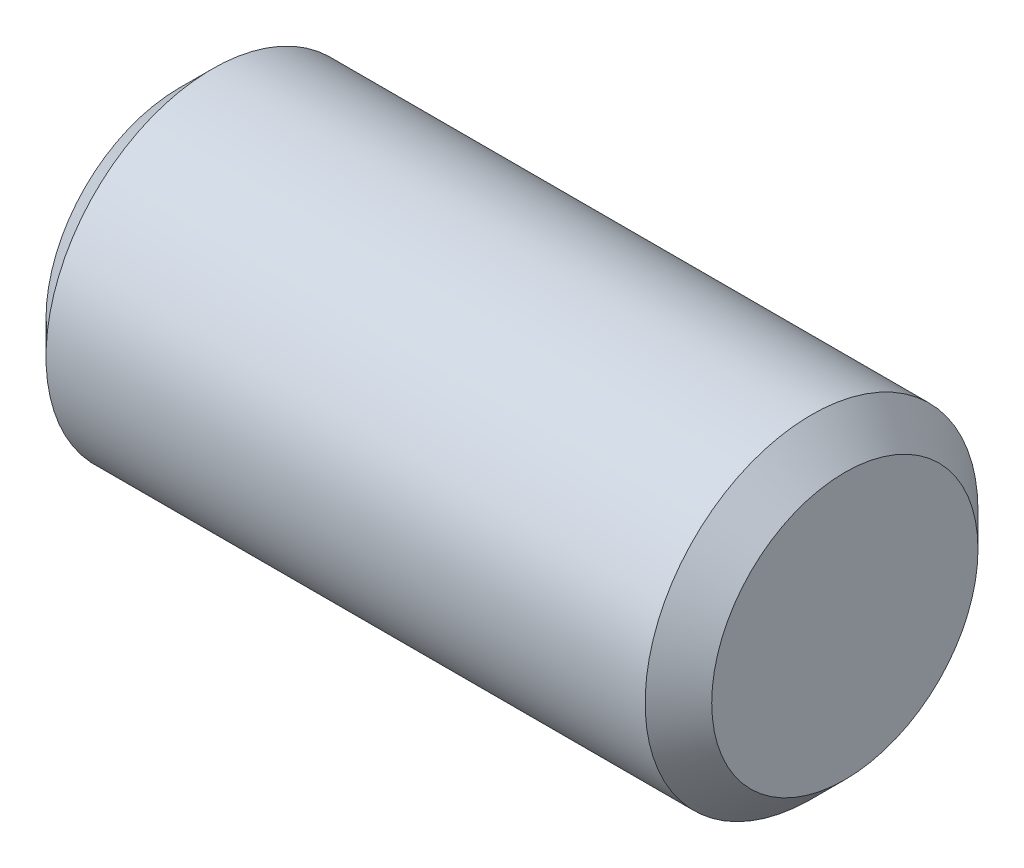
from build123d import *

# Parameters (mm, degrees)
SKETCH2_R           = 3
BOSS_EXTRUDE1_DEPTH = 6
CHAMFER2_SIZE       = 0.6


with BuildPart() as part:
    # Sketch2 → Boss-Extrude1 (new, symmetric)
    with BuildSketch(Plane(origin=(0, 0, 0), x_dir=(0, 0, -1), z_dir=(1, 0, 0))):
        Circle(SKETCH2_R)
    extrude(amount=BOSS_EXTRUDE1_DEPTH, both=True)

    # Chamfer2
    chamfer2_edges = [part.edges().sort_by_distance(p)[0] for p in [
        (6, 0, 3),
        (-6, 0, 3),
    ]]
    chamfer(chamfer2_edges, length=CHAMFER2_SIZE)


solid = part.part
